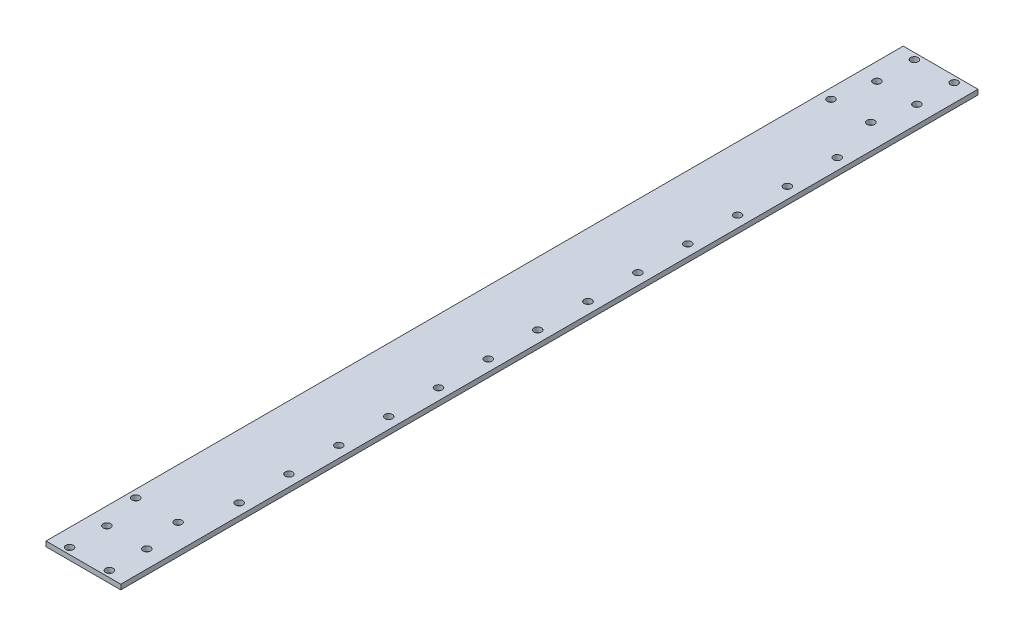
from build123d import *

# Parameters (mm, degrees)
BOSS_EXTRUDE1_DEPTH      = 200
BOSS_EXTRUDE1_DEPTH_BACK = 144
SKETCH1_W                = 30
SKETCH1_H                = 2
F_3_0_3_DIAMETER_SLOT1_D = 3
F_3_0MM_DOWEL_HOLE1_D    = 3


with BuildPart() as part:
    # Sketch1 → Boss-Extrude1 (new, two sides: drawn at the far end of the back side and taken through both)
    with BuildSketch(Plane.XY.offset(-BOSS_EXTRUDE1_DEPTH_BACK)):
        Rectangle(SKETCH1_W, SKETCH1_H)
    extrude(amount=BOSS_EXTRUDE1_DEPTH + BOSS_EXTRUDE1_DEPTH_BACK)

    # Ø3.0 (3) Diameter Slot1 (through all)
    with Locations(Plane(origin=(0, 1, 0), x_dir=(1, 0, 0), z_dir=(0, 1, 0))):
        with Locations((-8.05, 126.5), (7.95, 126.5), (7.95, 141.5), (-8.05, 141.5)):
            Hole(F_3_0_3_DIAMETER_SLOT1_D / 2)

    # Ø3.0mm Dowel Hole1 (through all)
    with Locations(Plane(origin=(0, -1, 0), x_dir=(-1, 0, 0), z_dir=(0, -1, 0))):
        with Locations((-7.95, -197.5), (8.05, -197.5), (8.05, -182.5), (-7.95, -182.5), (-5, -167), (12, -167), (-10.5, -148), (-10.5, -128), (-10.5, -108), (-10.5, -88), (-10.5, -68), (-10.5, -48), (-10.3, -28), (-10.5, -8), (-10.5, 12), (-10.5, 32), (-10.5, 52), (-10.5, 72), (-10.5, 92), (-5, 111), (11, 111)):
            Hole(F_3_0MM_DOWEL_HOLE1_D / 2)


solid = part.part
